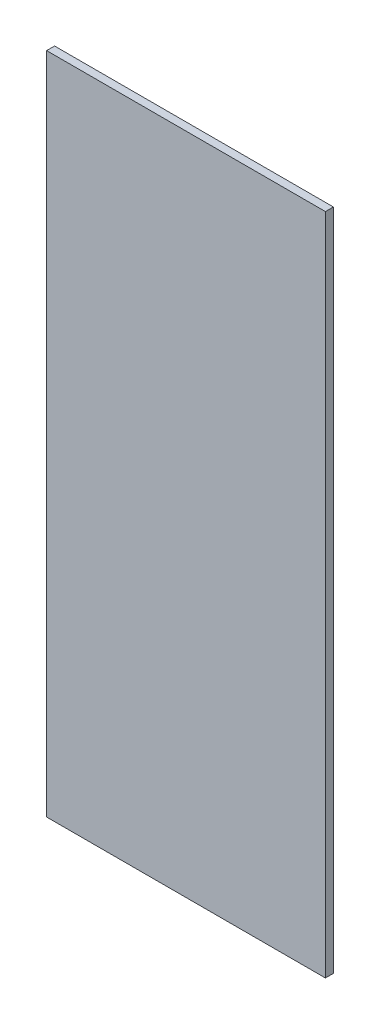
from build123d import *

# Parameters (mm, degrees)
SKETCH_1_W      = 105
SKETCH_1_H      = 250
EXTRUDE_1_DEPTH = 3


with BuildPart() as part:
    # 스케치1 → 보스-돌출1 (new body)
    with BuildSketch(Plane.XY):
        with Locations((52.5, 125)):
            Rectangle(SKETCH_1_W, SKETCH_1_H)
    extrude(amount=EXTRUDE_1_DEPTH)


solid = part.part
